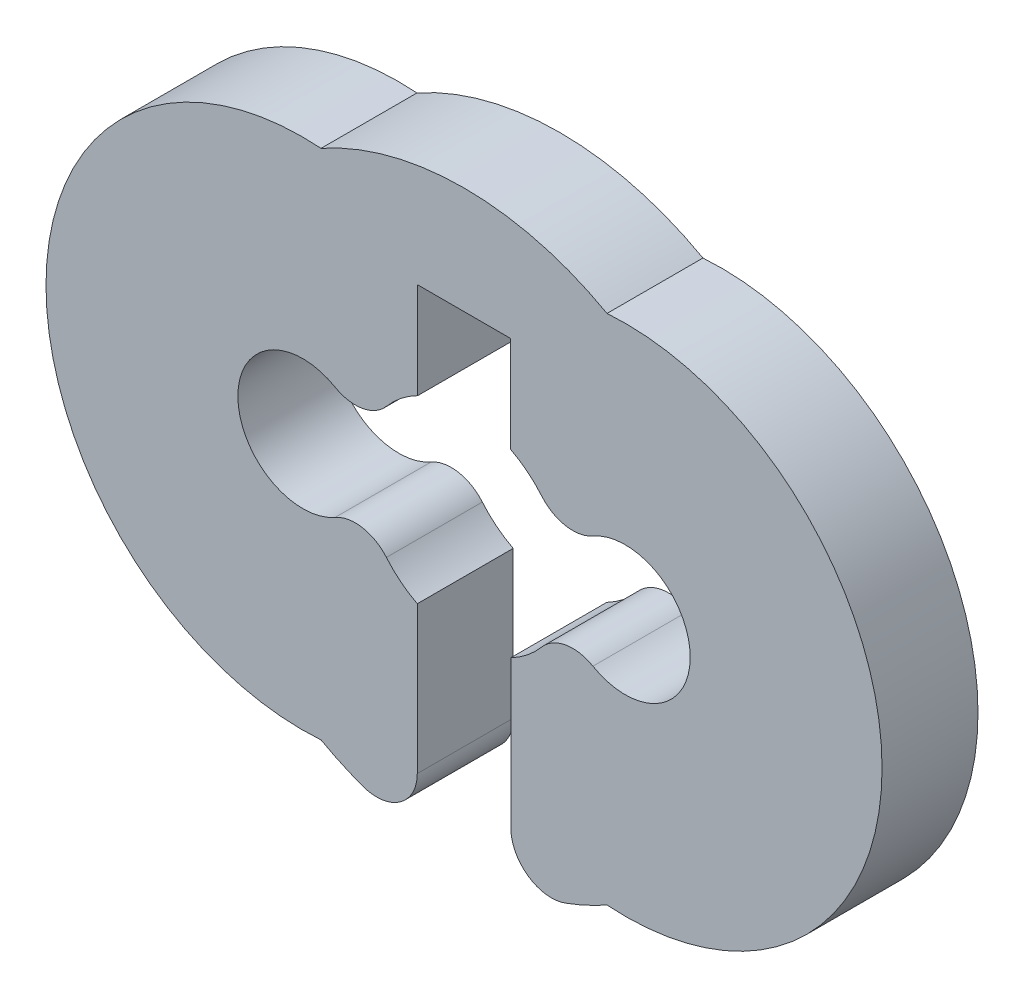
from build123d import *

# Parameters (mm, degrees)
EXTRUDE_1_DEPTH = 3
FILLET_1_R      = 1.27


with BuildPart() as part:
    # 스케치1 → 보스-돌출1 (new body)
    with BuildSketch(Plane.XY):
        with BuildLine():
            Line((-1.4475, 5.825839477), (1.4475, 5.825839477))
            Line((1.4475, 5.825839477), (1.4475, 2.825839477))
            ThreePointArc((1.4475, 2.825839477), (2.528752179, 1.919905575), (3.110851973, 0.635))
            ThreePointArc((3.110851973, 0.635), (7.073084861, 0), (3.110851973, -0.635))
            ThreePointArc((3.110851973, -0.635), (2.533845793, -1.913178115), (1.4625, -2.818105525))
            Line((1.4625, -2.818105525), (1.4625, -9.057688378))
            ThreePointArc((1.4625, -9.057688378), (3.012624602, -8.666297826), (4.471273428, -8.011762536))
            ThreePointArc((4.471273428, -8.011762536), (13.073084861, 0), (4.471273428, 8.011762536))
            ThreePointArc((4.471273428, 8.011762536), (0, 9.175), (-4.471273428, 8.011762536))
            ThreePointArc((-4.471273428, 8.011762536), (-13.073084861, 0), (-4.471273428, -8.011762536))
            ThreePointArc((-4.471273428, -8.011762536), (-3.012624602, -8.666297826), (-1.4625, -9.057688378))
            Line((-1.4625, -9.057688378), (-1.4625, -2.818105525))
            ThreePointArc((-1.4625, -2.818105525), (-2.533845793, -1.913178115), (-3.110851973, -0.635))
            ThreePointArc((-3.110851973, -0.635), (-7.073084861, 0), (-3.110851973, 0.635))
            ThreePointArc((-3.110851973, 0.635), (-2.528752179, 1.919905575), (-1.4475, 2.825839477))
            Line((-1.4475, 2.825839477), (-1.4475, 5.825839477))
        make_face()
    extrude(amount=EXTRUDE_1_DEPTH)

    # 필렛1
    fillet_1_edges = [part.edges().sort_by_distance(p)[0] for p in [
        (-3.110851973, 0.635, 1.5),
        (-3.110851973, -0.635, 1.5),
        (-1.4625, -9.057688378, 1.5),
        (1.4625, -9.057688378, 1.5),
        (3.110851973, -0.635, 1.5),
        (3.110851973, 0.635, 1.5),
    ]]
    fillet(fillet_1_edges, radius=FILLET_1_R)


solid = part.part
